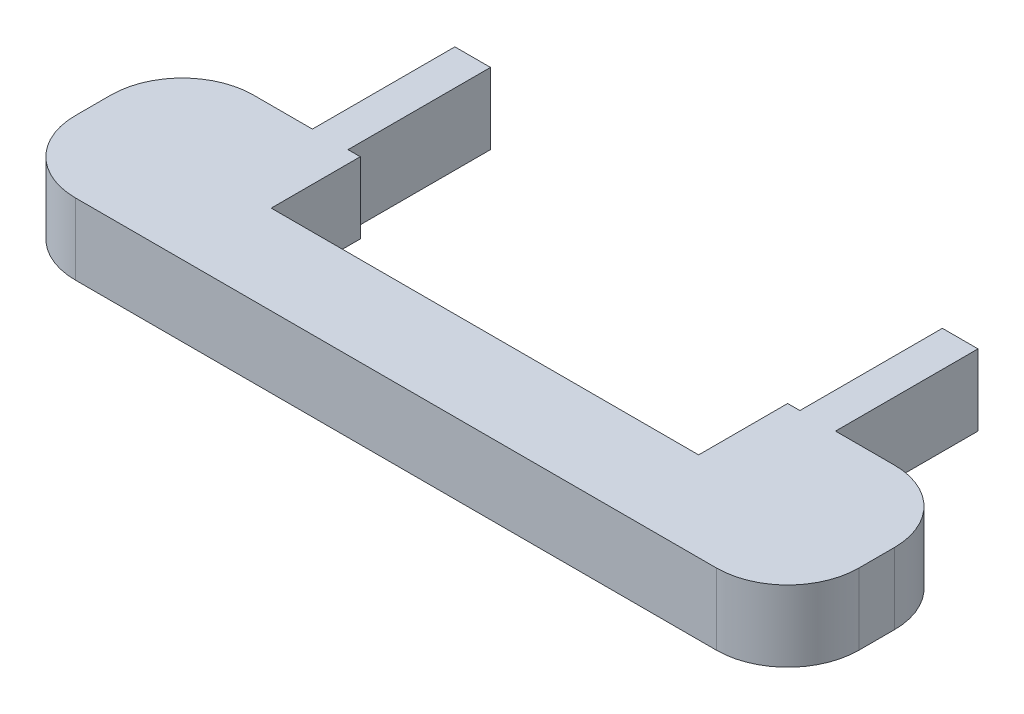
from build123d import *

# Parameters (mm, degrees)
SKETCH1_W           = 55.88
SKETCH1_H           = 12.7
BOSS_EXTRUDE1_DEPTH = 5.08
SKETCH2_W           = 30.48
SKETCH2_H           = 6.35
CUT_EXTRUDE1_DEPTH  = 5.08
FILLET1_R           = 5.08
SKETCH3_W           = 2.54
SKETCH3_H           = 5.08
BOSS_EXTRUDE2_DEPTH = 10.16


with BuildPart() as part:
    # Sketch1 → Boss-Extrude1 (new body)
    with BuildSketch(Plane(origin=(0, 0, 0), x_dir=(1, 0, 0), z_dir=(0, 1, 0))):
        Rectangle(SKETCH1_W, SKETCH1_H)
    extrude(amount=BOSS_EXTRUDE1_DEPTH)

    # Sketch2 → Cut-Extrude1 (cut)
    with BuildSketch(Plane(origin=(0, 5.08, 0), x_dir=(1, 0, 0), z_dir=(0, 1, 0))):
        with Locations((0, 3.175)):
            Rectangle(SKETCH2_W, SKETCH2_H)
    extrude(amount=-CUT_EXTRUDE1_DEPTH, mode=Mode.SUBTRACT)

    # Fillet1
    fillet1_edges = [part.edges().sort_by_distance(p)[0] for p in [
        (27.94, 2.54, 6.35),
        (-27.94, 2.54, 6.35),
        (-27.94, 2.54, -6.35),
        (27.94, 2.54, -6.35),
    ]]
    fillet(fillet1_edges, radius=FILLET1_R)

    # Sketch3 → Boss-Extrude2 (add)
    with BuildSketch(Plane(origin=(0, 0, -6.35), x_dir=(-1, 0, 0), z_dir=(0, 0, -1))):
        with Locations((17.382512253, 2.54)):
            Rectangle(SKETCH3_W, SKETCH3_H)
    boss_extrude2 = extrude(amount=BOSS_EXTRUDE2_DEPTH)

    # Mirror1: Boss-Extrude2 across plane
    add(boss_extrude2.mirror(Plane(origin=(0, 0, 0), x_dir=(0, 0, 1), z_dir=(1, 0, 0))))


solid = part.part
